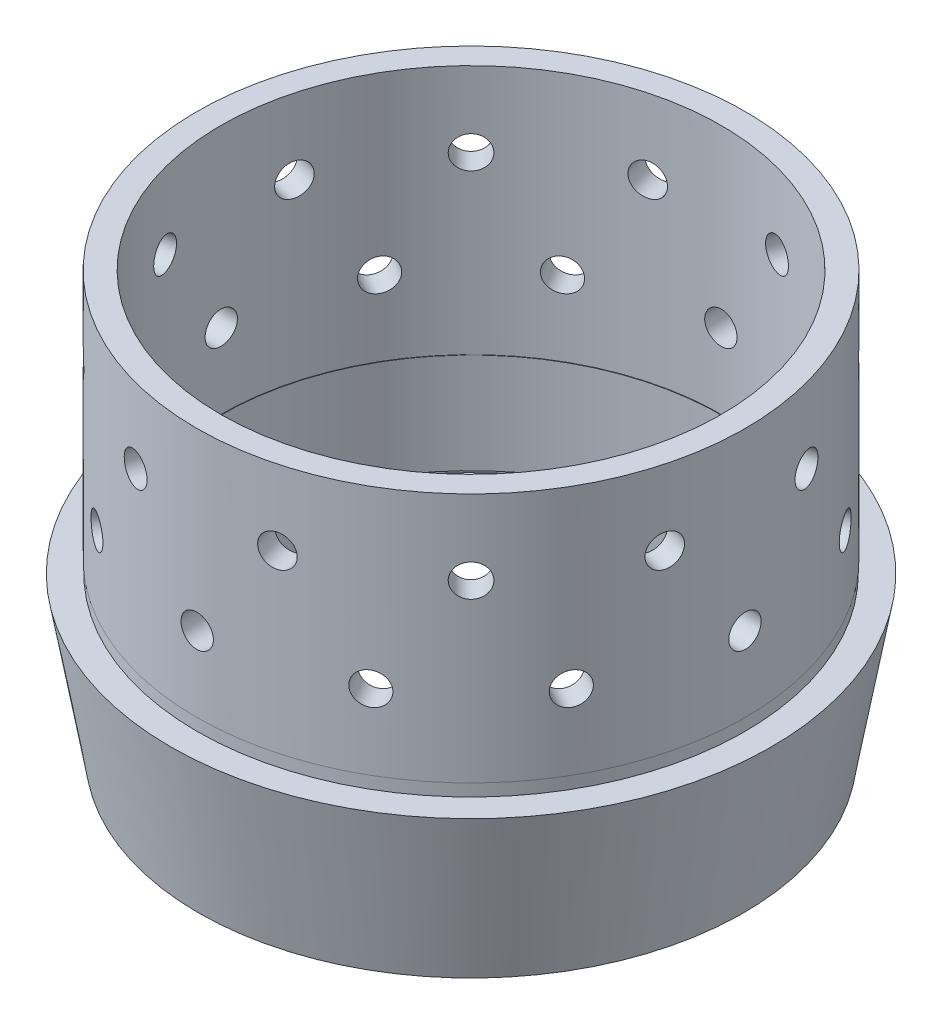
from build123d import *

# Parameters (mm, degrees)
SKETCH1_R               = 69.596
SKETCH1_R_2             = 63.5
BOSS_EXTRUDE1_DEPTH     = 63.5
CUT_EXTRUDE1_REACH      = 170.078
CUT_EXTRUDE1_END_RADIUS = 63.5
SKETCH2_R               = 4.1021
CIRPATTERN1_COUNT       = 12
CUT_EXTRUDE2_REACH      = 176.435
CUT_EXTRUDE2_END_RADIUS = 63.5
SKETCH3_R               = 4.1021
CIRPATTERN2_COUNT       = 12


with BuildPart() as part:
    # Sketch1 → Boss-Extrude1 (new body)
    with BuildSketch(Plane(origin=(0, 0, 0), x_dir=(1, 0, 0), z_dir=(0, 1, 0))):
        with Locations(Location((0, 0, 0), (0, 0, 270))):
            Circle(SKETCH1_R)
        with Locations(Location((0, 0, 0), (0, 0, 270))):
            Circle(SKETCH1_R_2, mode=Mode.SUBTRACT)
    extrude(amount=BOSS_EXTRUDE1_DEPTH)

    # Cut-Extrude1: up to this cylinder (the profile starts outside it)
    cut_extrude1_end = Plane(origin=(0, 19.05, 0), z_dir=(0, -1, 0)) * Cylinder(CUT_EXTRUDE1_END_RADIUS, 468.156, mode=Mode.PRIVATE)
    # Sketch2 → Cut-Extrude1 (cut, up to the surface)
    with BuildSketch(Plane.XY.offset(69.596), mode=Mode.PRIVATE) as cut_extrude1_sk1:
        with Locations((0, 19.05)):
            Circle(SKETCH2_R)
    cut_extrude1_tool1 = extrude(cut_extrude1_sk1.sketch, amount=-CUT_EXTRUDE1_REACH, mode=Mode.PRIVATE) - cut_extrude1_end
    cut_extrude1 = cut_extrude1_tool1.solids().sort_by_distance((0, 19.05, 69.596))[0]
    add(cut_extrude1, mode=Mode.SUBTRACT)

    # CirPattern1: Cut-Extrude1 ×12 about axis
    cirpattern1_axis = Axis((0, 63.5, 0), (0, -1, 0))
    for i in range(1, CIRPATTERN1_COUNT):
        add(cut_extrude1.rotate(cirpattern1_axis, i * 360 / CIRPATTERN1_COUNT), mode=Mode.SUBTRACT)

    # Cut-Extrude2: up to this cylinder (the profile starts outside it)
    cut_extrude2_end = Plane(origin=(0, 44.45, 0), z_dir=(0, -1, 0)) * Cylinder(CUT_EXTRUDE2_END_RADIUS, 480.87, mode=Mode.PRIVATE)
    # Sketch3 → Cut-Extrude2 (cut, up to the surface)
    with BuildSketch(Plane(origin=(-18.012770263, 0, 67.224573806), x_dir=(0, -1, 0), z_dir=(-0.25881904510252135, 0, 0.9659258262890681)), mode=Mode.PRIVATE) as cut_extrude2_sk1:
        with Locations(Location((-44.45, 0, 0), (0, 0, 90))):
            Circle(SKETCH3_R)
    cut_extrude2_tool1 = extrude(cut_extrude2_sk1.sketch, amount=-CUT_EXTRUDE2_REACH, mode=Mode.PRIVATE) - cut_extrude2_end
    cut_extrude2 = cut_extrude2_tool1.solids().sort_by_distance((-18.01277, 44.45, 67.224574))[0]
    add(cut_extrude2, mode=Mode.SUBTRACT)

    # CirPattern2: Cut-Extrude2 ×12 about axis
    cirpattern2_axis = Axis((0, 63.5, 0), (0, -1, 0))
    for i in range(1, CIRPATTERN2_COUNT):
        add(cut_extrude2.rotate(cirpattern2_axis, i * 360 / CIRPATTERN2_COUNT), mode=Mode.SUBTRACT)

    # Sketch4 → Revolve1 (revolve)
    with BuildSketch(Plane(origin=(0, 0, 0), x_dir=(0.9135454576425946, 0, 0.4067366430758145), z_dir=(-0.4067366430758145, 0, 0.9135454576425946)), mode=Mode.PRIVATE) as revolve1_sk:
        Polygon((-63.373, 0), (-69.469, 0), (-69.469, -3.175), (-76.2, -3.175), (-69.146039137, -43.18), (-63.373, -43.18), (-63.373, -31.749123985), (-63.373, -28.1686), (-66.675, -28.1686), (-66.675, -25.4), (-63.373, -25.4), align=None)
    revolve(revolve1_sk.sketch.rotate(Axis((0, 63.5, 0), (0, -1, 0)), 246), axis=Axis((0, 63.5, 0), (0, -1, 0)))


solid = part.part
